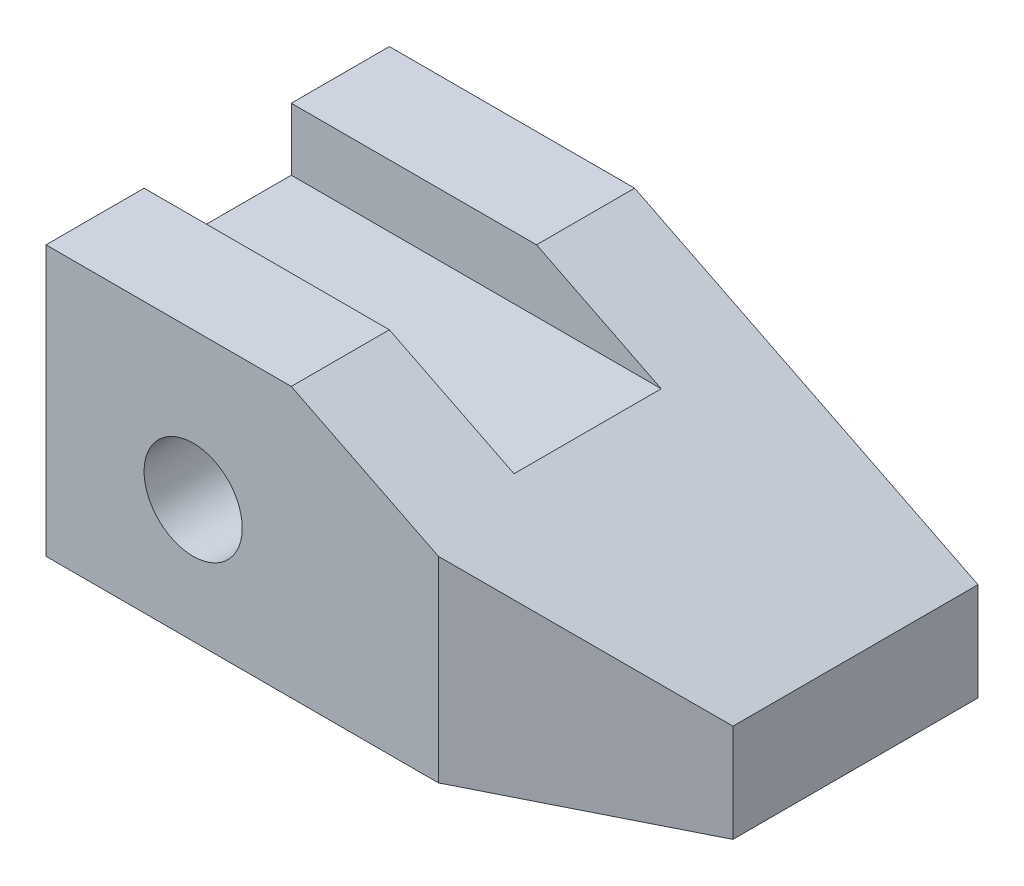
from build123d import *

# Parameters (mm, degrees)
SKETCH1_R           = 12.7
BOSS_EXTRUDE1_DEPTH = 88.9
CUT_EXTRUDE1_DEPTH  = 169.930467649
SKETCH3_W           = 38.1
SKETCH3_H           = 16.138601809
CUT_EXTRUDE2_DEPTH  = 254


with BuildPart() as part:
    # Sketch1 → Boss-Extrude1 (new body)
    with BuildSketch(Plane.XY):
        Polygon((-125.52, 46.92), (26.88, 46.92), (26.88, 72.32), (-62.02, 116.77), (-125.52, 116.77), align=None)
        with Locations((-87.42, 78.67)):
            Circle(SKETCH1_R, mode=Mode.SUBTRACT)
    extrude(amount=BOSS_EXTRUDE1_DEPTH)

    # Sketch2 → Cut-Extrude1 (cut, through all)
    with BuildSketch(Plane(origin=(0, 116.77, 0), x_dir=(1, 0, 0), z_dir=(0, 1, 0))):
        Polygon((26.88, -63.451430224), (-23.92, -88.9), (26.88, -88.9), align=None)
    extrude(amount=-CUT_EXTRUDE1_DEPTH, mode=Mode.SUBTRACT)

    # Sketch3 → Cut-Extrude2 (cut)
    with BuildSketch(Plane.ZY.offset(125.52)):
        with Locations((44.45, 108.700699095)):
            Rectangle(SKETCH3_W, SKETCH3_H)
    extrude(amount=-CUT_EXTRUDE2_DEPTH, mode=Mode.SUBTRACT)


solid = part.part
